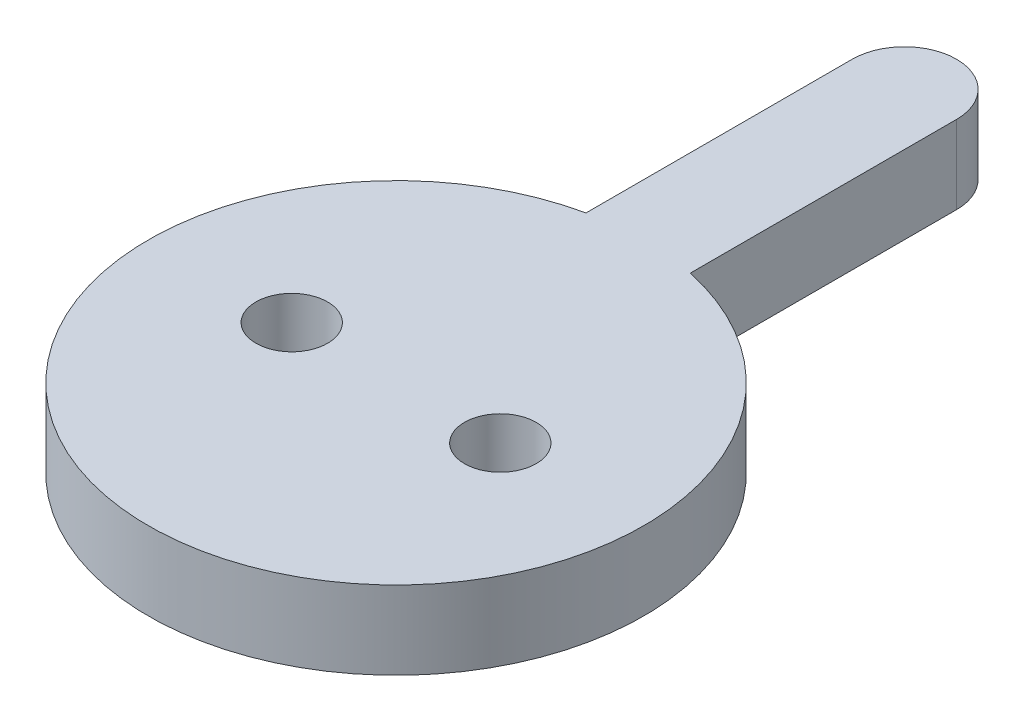
from build123d import *

# Parameters (mm, degrees)
SKETCH1_R           = 19
BOSS_EXTRUDE1_DEPTH = 6
SKETCH3_R           = 14.86
BOSS_EXTRUDE2_DEPTH = 2
SKETCH2_R           = 2.75
CUT_EXTRUDE1_DEPTH  = 10


with BuildPart() as part:
    # Sketch1 → Boss-Extrude1 (new body)
    with BuildSketch(Plane(origin=(0, 0, 0), x_dir=(1, 0, 0), z_dir=(0, 1, 0))):
        with BuildLine():
            ThreePointArc((-4, 39), (0, 43), (4, 39))
            Line((4, 39), (0, 39))
            Line((0, 39), (-4, 39))
        make_face()
        with BuildLine():
            ThreePointArc((-4, 18.574175621), (-2.011300972, 18.893243988), (0, 19))
            Line((0, 19), (0, 39))
            Line((0, 39), (-4, 39))
            Line((-4, 39), (-4, 18.574175621))
        make_face()
        with BuildLine():
            Line((0, 39), (0, 19))
            ThreePointArc((0, 19), (2.011300972, 18.893243988), (4, 18.574175621))
            Line((4, 18.574175621), (4, 39))
            Line((4, 39), (0, 39))
        make_face()
        Circle(SKETCH1_R)
    extrude(amount=BOSS_EXTRUDE1_DEPTH)

    # Sketch3 → Boss-Extrude2 (add)
    with BuildSketch(Plane.XZ):
        with Locations(Location((0, 0, 0), (0, 0, 90))):
            Circle(SKETCH3_R)
    extrude(amount=BOSS_EXTRUDE2_DEPTH)

    # Sketch2 → Cut-Extrude1 (cut)
    with BuildSketch(Plane(origin=(0, 6, 0), x_dir=(1, 0, 0), z_dir=(0, 1, 0))):
        with Locations(Location((8, 0, 0), (0, 0, 270))):
            Circle(SKETCH2_R)
        with Locations(Location((-8, 0, 0), (0, 0, 270))):
            Circle(SKETCH2_R)
    extrude(amount=-CUT_EXTRUDE1_DEPTH, mode=Mode.SUBTRACT)


solid = part.part
